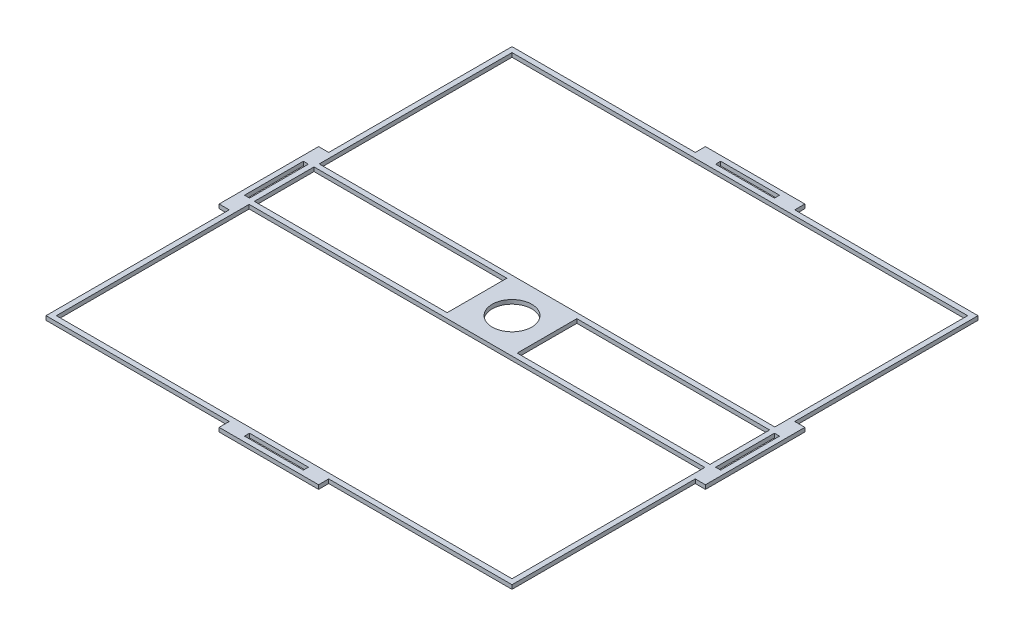
from build123d import *

# Parameters (mm, degrees)
SKETCH1_W           = 0.25
SKETCH1_H           = 1
SKETCH1_W_2         = 22.96
SKETCH1_H_2         = 22.96
SKETCH1_W_3         = 22.45
SKETCH1_H_3         = 22.45
SKETCH1_W_4         = 9.5
SKETCH1_H_4         = 0.255
SKETCH1_W_5         = 3.45
SKETCH1_H_5         = 3.45
SKETCH1_R           = 0.975
SKETCH1_W_6         = 1
SKETCH1_H_6         = 0.25
SKETCH1_W_7         = 4.9
SKETCH1_H_7         = 4.9
BOSS_EXTRUDE5_DEPTH = 0.2


with BuildPart() as part:
    # Sketch1 → Boss-Extrude5 (new body)
    # profile 1 of 18: a face of its own
    with BuildSketch(Plane(origin=(0, 0, 0), x_dir=(1, 0, 0), z_dir=(0, 1, 0))):
        with Locations((-11.605, -1.95)):
            Rectangle(SKETCH1_W, SKETCH1_H)
    # profile 2 of 18: a face of its own
    with BuildSketch(Plane(origin=(0, 0, 0), x_dir=(1, 0, 0), z_dir=(0, 1, 0))):
        with Locations((-11.605, 1.95)):
            Rectangle(SKETCH1_W, SKETCH1_H)
    # profile 3 of 18: a face of its own
    with BuildSketch(Plane(origin=(0, 0, 0), x_dir=(1, 0, 0), z_dir=(0, 1, 0))):
        Rectangle(SKETCH1_W_2, SKETCH1_H_2)
        Rectangle(SKETCH1_W_3, SKETCH1_H_3, mode=Mode.SUBTRACT)
    # profile 4 of 18: a face of its own
    with BuildSketch(Plane(origin=(0, 0, 0), x_dir=(1, 0, 0), z_dir=(0, 1, 0))):
        with Locations((-6.475, 1.5975)):
            Rectangle(SKETCH1_W_4, SKETCH1_H_4)
    # profile 5 of 18: a face of its own
    with BuildSketch(Plane(origin=(0, 0, 0), x_dir=(1, 0, 0), z_dir=(0, 1, 0))):
        with Locations((-6.475, -1.5975)):
            Rectangle(SKETCH1_W_4, SKETCH1_H_4)
    # profile 6 of 18: a face of its own
    with BuildSketch(Plane(origin=(0, 0, 0), x_dir=(1, 0, 0), z_dir=(0, 1, 0))):
        with Locations((6.475, 1.5975)):
            Rectangle(SKETCH1_W_4, SKETCH1_H_4)
    # profile 7 of 18: a face of its own
    with BuildSketch(Plane(origin=(0, 0, 0), x_dir=(1, 0, 0), z_dir=(0, 1, 0))):
        with Locations((6.475, -1.5975)):
            Rectangle(SKETCH1_W_4, SKETCH1_H_4)
    # profile 8 of 18: a face of its own
    with BuildSketch(Plane(origin=(0, 0, 0), x_dir=(1, 0, 0), z_dir=(0, 1, 0))):
        with Locations((11.605, 1.95)):
            Rectangle(SKETCH1_W, SKETCH1_H)
    # profile 9 of 18: a face of its own
    with BuildSketch(Plane(origin=(0, 0, 0), x_dir=(1, 0, 0), z_dir=(0, 1, 0))):
        with Locations((11.605, -1.95)):
            Rectangle(SKETCH1_W, SKETCH1_H)
    # profile 10 of 18: a face of its own
    with BuildSketch(Plane(origin=(0, 0, 0), x_dir=(1, 0, 0), z_dir=(0, 1, 0))):
        Rectangle(SKETCH1_W_5, SKETCH1_H_5)
        with Locations(Location((0, 0, 0), (0, 0, 270))):
            Circle(SKETCH1_R, mode=Mode.SUBTRACT)
    # profile 11 of 18: a face of its own
    with BuildSketch(Plane(origin=(0, 0, 0), x_dir=(1, 0, 0), z_dir=(0, 1, 0))):
        Polygon((-1.45, -11.73), (-2.45, -11.73), (-2.45, -11.98), (2.45, -11.98), (2.45, -11.73), (1.45, -11.73), align=None)
    # profile 12 of 18: a face of its own
    with BuildSketch(Plane(origin=(0, 0, 0), x_dir=(1, 0, 0), z_dir=(0, 1, 0))):
        with Locations((1.95, -11.605)):
            Rectangle(SKETCH1_W_6, SKETCH1_H_6)
    # profile 13 of 18: a face of its own
    with BuildSketch(Plane(origin=(0, 0, 0), x_dir=(1, 0, 0), z_dir=(0, 1, 0))):
        with Locations((-1.95, -11.605)):
            Rectangle(SKETCH1_W_6, SKETCH1_H_6)
    # profile 14 of 18: a face of its own
    with BuildSketch(Plane(origin=(0, 0, 0), x_dir=(1, 0, 0), z_dir=(0, 1, 0))):
        Polygon((11.98, 2.45), (11.73, 2.45), (11.73, 1.45), (11.73, -1.45), (11.73, -2.45), (11.98, -2.45), align=None)
    # profile 15 of 18: a face of its own
    with BuildSketch(Plane(origin=(0, 0, 0), x_dir=(1, 0, 0), z_dir=(0, 1, 0))):
        with Locations((1.95, 11.605)):
            Rectangle(SKETCH1_W_6, SKETCH1_H_6)
    # profile 16 of 18: a face of its own
    with BuildSketch(Plane(origin=(0, 0, 0), x_dir=(1, 0, 0), z_dir=(0, 1, 0))):
        with Locations((0, 11.855)):
            Rectangle(SKETCH1_W_7, SKETCH1_H_6)
    # profile 17 of 18: a face of its own
    with BuildSketch(Plane(origin=(0, 0, 0), x_dir=(1, 0, 0), z_dir=(0, 1, 0))):
        with Locations((-1.95, 11.605)):
            Rectangle(SKETCH1_W_6, SKETCH1_H_6)
    # profile 18 of 18: a face of its own
    with BuildSketch(Plane(origin=(0, 0, 0), x_dir=(1, 0, 0), z_dir=(0, 1, 0))):
        with Locations((-11.855, 0)):
            Rectangle(SKETCH1_W, SKETCH1_H_7)
    extrude(amount=BOSS_EXTRUDE5_DEPTH)


solid = part.part
